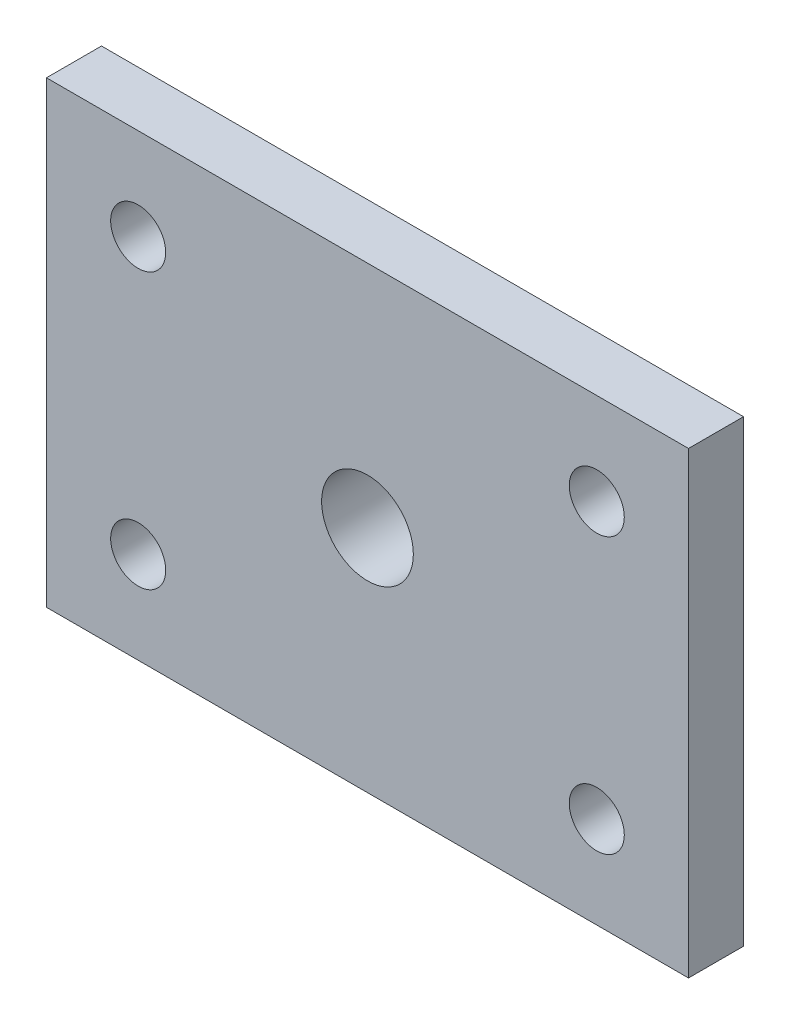
from build123d import *

# Parameters (mm, degrees)
SKETCH1_W           = 35
SKETCH1_H           = 25
BOSS_EXTRUDE1_DEPTH = 3
SKETCH2_R           = 2.5
SKETCH2_R_2         = 1.5
CUT_EXTRUDE1_DEPTH  = 3
SKETCH3_R           = 7.5
SKETCH3_R_2         = 2.5
BOSS_EXTRUDE2_DEPTH = 5


with BuildPart() as part:
    # Sketch1 → Boss-Extrude1 (new body)
    with BuildSketch(Plane.XY):
        Rectangle(SKETCH1_W, SKETCH1_H)
    extrude(amount=BOSS_EXTRUDE1_DEPTH)

    # Sketch2 → Cut-Extrude1 (cut)
    with BuildSketch(Plane.XY.offset(3)):
        Circle(SKETCH2_R)
        with Locations((-12.5, 7.5)):
            Circle(SKETCH2_R_2)
        with Locations((12.5, 7.5)):
            Circle(SKETCH2_R_2)
        with Locations((12.5, -7.5)):
            Circle(SKETCH2_R_2)
        with Locations((-12.5, -7.5)):
            Circle(SKETCH2_R_2)
    extrude(amount=-CUT_EXTRUDE1_DEPTH, mode=Mode.SUBTRACT)

    # Sketch3 → Boss-Extrude2 (add)
    with BuildSketch(Plane(origin=(0, 0, 0), x_dir=(-1, 0, 0), z_dir=(0, 0, -1))):
        with Locations(Location((0, 0, 0), (0, 0, 180))):
            Circle(SKETCH3_R)
        with Locations(Location((0, 0, 0), (0, 0, 180))):
            Circle(SKETCH3_R_2, mode=Mode.SUBTRACT)
    extrude(amount=BOSS_EXTRUDE2_DEPTH)


solid = part.part
